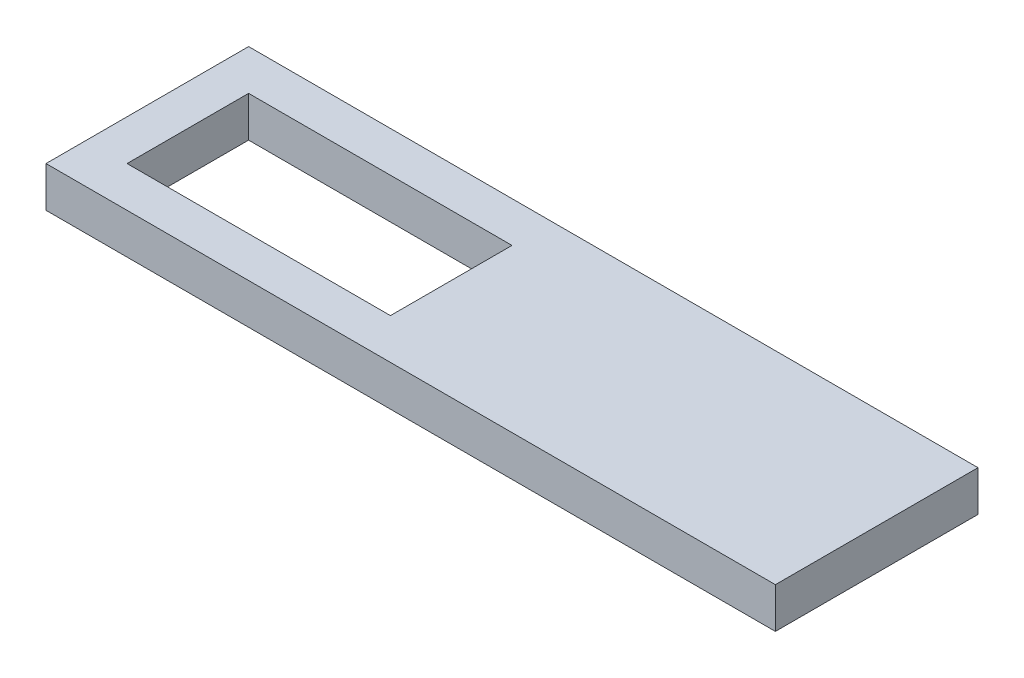
from build123d import *

# Parameters (mm, degrees)
SKETCH1_W           = 114.3
SKETCH1_H           = 6.35
BOSS_EXTRUDE1_DEPTH = 31.75
SKETCH2_W           = 41.275
SKETCH2_H           = 19.05
CUT_EXTRUDE2_DEPTH  = 83.793870546


with BuildPart() as part:
    # Sketch1 → Boss-Extrude1 (new body)
    with BuildSketch(Plane.XY):
        with Locations((-19.05, -155.575)):
            Rectangle(SKETCH1_W, SKETCH1_H)
    extrude(amount=BOSS_EXTRUDE1_DEPTH)

    # Sketch2 → Cut-Extrude2 (cut, through all)
    with BuildSketch(Plane.XZ.offset(158.75)):
        with Locations((-49.2125, 15.875)):
            Rectangle(SKETCH2_W, SKETCH2_H)
    extrude(amount=-CUT_EXTRUDE2_DEPTH, mode=Mode.SUBTRACT)


solid = part.part
